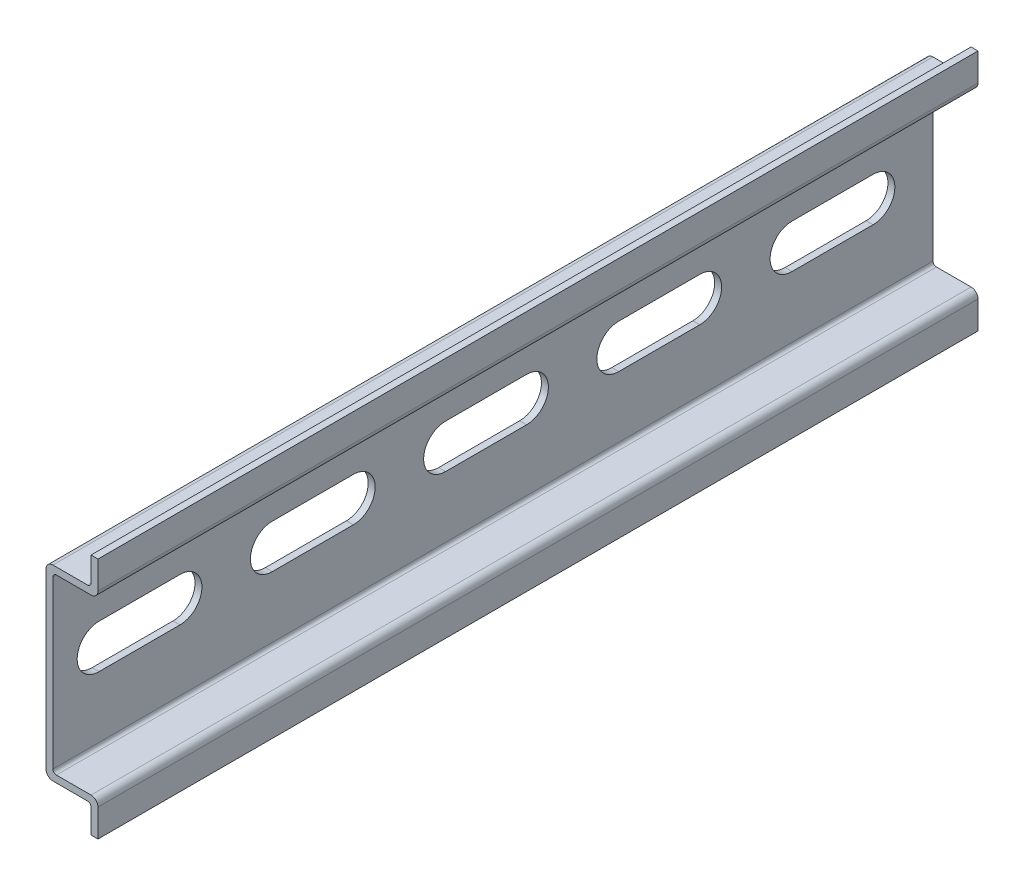
from build123d import *

# Parameters (mm, degrees)
BOSS_EXTRUDE1_DEPTH = 500
CUT_EXTRUDE1_DEPTH  = 7.5
LPATTERN1_COUNT     = 40
LPATTERN1_PITCH     = 25
CUT_EXTRUDE2_START  = -127
SKETCH3_W           = 18.151488818
SKETCH3_H           = 38.961529028
CUT_EXTRUDE2_DEPTH  = 874.181233577


with BuildPart() as part:
    # Sketch1 → Boss-Extrude1 (new, symmetric)
    with BuildSketch(Plane.XY):
        with BuildLine():
            Line((7.5, 17.5), (6.5, 17.5))
            Line((6.5, 17.5), (6.5, 14))
            ThreePointArc((6.5, 14), (6.353553391, 13.646446609), (6, 13.5))
            Line((6, 13.5), (1, 13.5))
            ThreePointArc((1, 13.5), (0.292893219, 13.207106781), (0, 12.5))
            Line((0, 12.5), (0, -12.5))
            ThreePointArc((0, -12.5), (0.292893219, -13.207106781), (1, -13.5))
            Line((1, -13.5), (6, -13.5))
            ThreePointArc((6, -13.5), (6.353553391, -13.646446609), (6.5, -14))
            Line((6.5, -14), (6.5, -17.5))
            Line((6.5, -17.5), (7.5, -17.5))
            Line((7.5, -17.5), (7.5, -13.5))
            ThreePointArc((7.5, -13.5), (7.207106781, -12.792893219), (6.5, -12.5))
            Line((6.5, -12.5), (1.5, -12.5))
            ThreePointArc((1.5, -12.5), (1.146446609, -12.353553391), (1, -12))
            Line((1, -12), (1, 12))
            ThreePointArc((1, 12), (1.146446609, 12.353553391), (1.5, 12.5))
            Line((1.5, 12.5), (6.5, 12.5))
            ThreePointArc((6.5, 12.5), (7.207106781, 12.792893219), (7.5, 13.5))
            Line((7.5, 13.5), (7.5, 17.5))
        make_face()
    extrude(amount=BOSS_EXTRUDE1_DEPTH, both=True)

    # Sketch2 → Cut-Extrude1 (cut)
    with BuildSketch(Plane(origin=(0, 0, 0), x_dir=(0, 0, -1), z_dir=(1, 0, 0))):
        with BuildLine():
            Line((-493.35, 3.15), (-481.65, 3.15))
            ThreePointArc((-481.65, 3.15), (-478.5, 0), (-481.65, -3.15))
            Line((-481.65, -3.15), (-493.35, -3.15))
            ThreePointArc((-493.35, -3.15), (-496.5, 0), (-493.35, 3.15))
        make_face()
    cut_extrude1 = extrude(amount=CUT_EXTRUDE1_DEPTH, mode=Mode.SUBTRACT)

    # LPattern1: Cut-Extrude1 ×40
    with Locations(*[(0, 0, -i * LPATTERN1_PITCH) for i in range(1, LPATTERN1_COUNT)]):
        add(cut_extrude1, mode=Mode.SUBTRACT)

    # Sketch3 → Cut-Extrude2 (cut, through all)
    with BuildSketch(Plane.XY.offset(500).offset(CUT_EXTRUDE2_START)):
        with Locations((4.262528883, -0.137511279)):
            Rectangle(SKETCH3_W, SKETCH3_H)
    extrude(amount=-CUT_EXTRUDE2_DEPTH, mode=Mode.SUBTRACT)


solid = part.part
